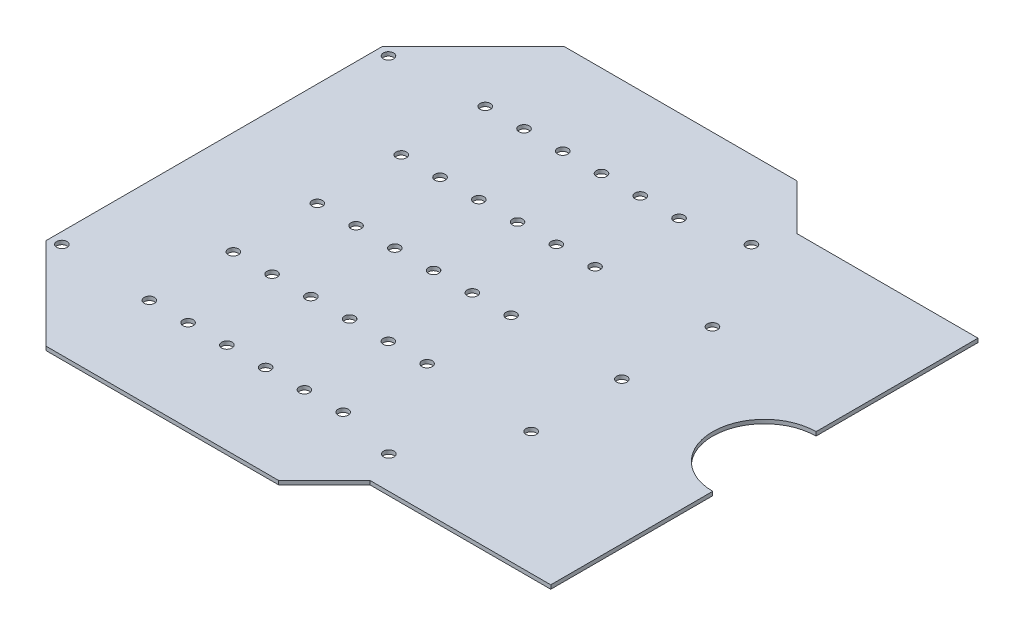
from build123d import *

# Parameters (mm, degrees)
Y_KSEKLIK_EKSTR_ZYON1_DEPTH = 1.5
IZIM2_R                     = 2
KES_EKSTR_ZYON1_DEPTH       = 10
IZIM3_R                     = 2
KES_EKSTR_ZYON2_DEPTH       = 10
IZIM4_R                     = 20
KES_EKSTR_ZYON3_DEPTH       = 10


with BuildPart() as part:
    # Çizim1 → Yükseklik-Ekstrüzyon1 (new body)
    with BuildSketch(Plane(origin=(0, 0, 0), x_dir=(1, 0, 0), z_dir=(0, 1, 0))):
        Polygon((-27.784830075, -18.817907641), (-27.784830075, 111.182092359), (7.570508985, 146.537431418), (97.570508985, 146.537431418), (115.248178514, 128.859761888), (185.248178514, 128.859761888), (185.248178514, -36.495577171), (115.248178514, -36.495577171), (97.570508985, -54.173246701), (7.570508985, -54.173246701), align=None)
    extrude(amount=Y_KSEKLIK_EKSTR_ZYON1_DEPTH)

    # Çizim2 → Kes-Ekstrüzyon1 (cut)
    with BuildSketch(Plane(origin=(0, 1.5, 0), x_dir=(1, 0, 0), z_dir=(0, 1, 0))):
        with Locations(Location((-23.433357477, 109.379653392, 0), (0, 0, 270))):
            Circle(IZIM2_R)
        with Locations(Location((-23.433357477, -17.015468675, 0), (0, 0, 270))):
            Circle(IZIM2_R)
        with Locations(Location((110.070471674, -23.995487096, 0), (0, 0, 270))):
            Circle(IZIM2_R)
        with Locations(Location((110.070471674, 116.359671813, 0), (0, 0, 270))):
            Circle(IZIM2_R)
        with Locations(Location((130.070471674, 46.182092359, 0), (0, 0, 270))):
            Circle(IZIM2_R)
        with Locations(Location((130.070471674, 81.270882086, 0), (0, 0, 270))):
            Circle(IZIM2_R)
        with Locations(Location((130.070471674, 11.093302631, 0), (0, 0, 270))):
            Circle(IZIM2_R)
    extrude(amount=-KES_EKSTR_ZYON1_DEPTH, mode=Mode.SUBTRACT)

    # Çizim3 → Kes-Ekstrüzyon2 (cut)
    with BuildSketch(Plane(origin=(0, 1.5, 0), x_dir=(1, 0, 0), z_dir=(0, 1, 0))):
        with Locations(Location((12.215169925, 46.182092359, 0), (0, 0, 270))):
            Circle(IZIM3_R)
        with Locations(Location((12.215169925, 78.682092359, 0), (0, 0, 270))):
            Circle(IZIM3_R)
        with Locations(Location((12.215169925, 13.682092359, 0), (0, 0, 270))):
            Circle(IZIM3_R)
        with Locations(Location((27.215169925, 78.682092359, 0), (0, 0, 270))):
            Circle(IZIM3_R)
        with Locations(Location((42.215169925, 78.682092359, 0), (0, 0, 270))):
            Circle(IZIM3_R)
        with Locations(Location((57.215169925, 78.682092359, 0), (0, 0, 270))):
            Circle(IZIM3_R)
        with Locations(Location((72.215169925, 78.682092359, 0), (0, 0, 270))):
            Circle(IZIM3_R)
        with Locations(Location((87.215169925, 78.682092359, 0), (0, 0, 270))):
            Circle(IZIM3_R)
        with Locations(Location((27.215169925, 46.182092359, 0), (0, 0, 270))):
            Circle(IZIM3_R)
        with Locations(Location((42.215169925, 46.182092359, 0), (0, 0, 270))):
            Circle(IZIM3_R)
        with Locations(Location((57.215169925, 46.182092359, 0), (0, 0, 270))):
            Circle(IZIM3_R)
        with Locations(Location((72.215169925, 46.182092359, 0), (0, 0, 270))):
            Circle(IZIM3_R)
        with Locations(Location((87.215169925, 46.182092359, 0), (0, 0, 270))):
            Circle(IZIM3_R)
        with Locations(Location((27.215169925, 13.682092359, 0), (0, 0, 270))):
            Circle(IZIM3_R)
        with Locations(Location((42.215169925, 13.682092359, 0), (0, 0, 270))):
            Circle(IZIM3_R)
        with Locations(Location((57.215169925, 13.682092359, 0), (0, 0, 270))):
            Circle(IZIM3_R)
        with Locations(Location((72.215169925, 13.682092359, 0), (0, 0, 270))):
            Circle(IZIM3_R)
        with Locations(Location((87.215169925, 13.682092359, 0), (0, 0, 270))):
            Circle(IZIM3_R)
        with Locations(Location((12.215169925, -18.817907641, 0), (0, 0, 270))):
            Circle(IZIM3_R)
        with Locations(Location((12.215169925, 111.182092359, 0), (0, 0, 270))):
            Circle(IZIM3_R)
        with Locations(Location((27.215169925, 111.182092359, 0), (0, 0, 270))):
            Circle(IZIM3_R)
        with Locations(Location((42.215169925, 111.182092359, 0), (0, 0, 270))):
            Circle(IZIM3_R)
        with Locations(Location((57.215169925, 111.182092359, 0), (0, 0, 270))):
            Circle(IZIM3_R)
        with Locations(Location((72.215169925, 111.182092359, 0), (0, 0, 270))):
            Circle(IZIM3_R)
        with Locations(Location((87.215169925, 111.182092359, 0), (0, 0, 270))):
            Circle(IZIM3_R)
        with Locations(Location((27.215169925, -18.817907641, 0), (0, 0, 270))):
            Circle(IZIM3_R)
        with Locations(Location((42.215169925, -18.817907641, 0), (0, 0, 270))):
            Circle(IZIM3_R)
        with Locations(Location((57.215169925, -18.817907641, 0), (0, 0, 270))):
            Circle(IZIM3_R)
        with Locations(Location((72.215169925, -18.817907641, 0), (0, 0, 270))):
            Circle(IZIM3_R)
        with Locations(Location((87.215169925, -18.817907641, 0), (0, 0, 270))):
            Circle(IZIM3_R)
    extrude(amount=-KES_EKSTR_ZYON2_DEPTH, mode=Mode.SUBTRACT)

    # Çizim4 → Kes-Ekstrüzyon3 (cut)
    with BuildSketch(Plane(origin=(0, 1.5, 0), x_dir=(1, 0, 0), z_dir=(0, 1, 0))):
        with Locations((185.248178514, 46.182092359)):
            Circle(IZIM4_R)
    extrude(amount=-KES_EKSTR_ZYON3_DEPTH, mode=Mode.SUBTRACT)


solid = part.part
